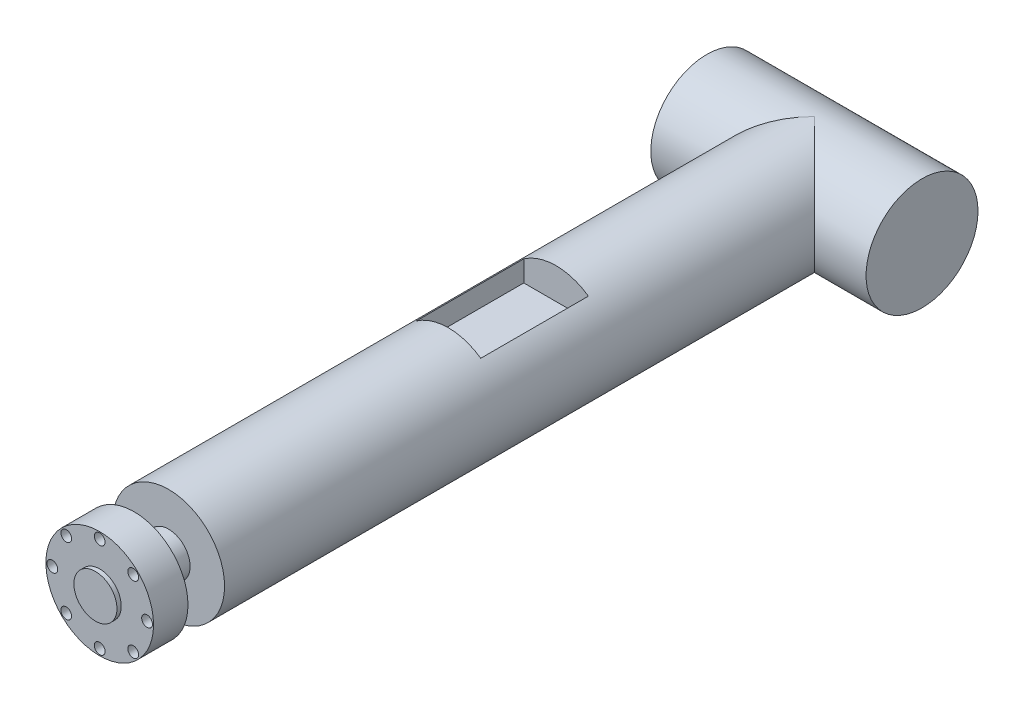
from build123d import *

# Parameters (mm, degrees)
AUFSATZ_LINEAR_AUSTRAGEN1_DEPTH      = 25
AUFSATZ_LINEAR_AUSTRAGEN1_DEPTH_BACK = 25
SKIZZE1_R                            = 13
SKIZZE2_R                            = 13
AUFSATZ_LINEAR_AUSTRAGEN2_DEPTH      = 150
SKIZZE4_R                            = 5
AUFSATZ_LINEAR_AUSTRAGEN3_DEPTH      = 16
SKIZZE5_R                            = 12.5
AUFSATZ_LINEAR_AUSTRAGEN4_DEPTH      = 8
SKIZZE6_R                            = 5
AUFSATZ_LINEAR_AUSTRAGEN5_DEPTH      = 1
SCHNITT_LINEAR_AUSTRAGEN2_REACH      = 183.204
SKIZZE7_R                            = 1.25
SCHNITT_LINEAR_AUSTRAGEN3_REACH      = 171.901
SKIZZE8_W                            = 15
SKIZZE8_H                            = 25


with BuildPart() as part:
    # Skizze1 → Aufsatz-Linear austragen1 (new, two sides: drawn at the far end of the back side and taken through both)
    with BuildSketch(Plane(origin=(0, 0, 0), x_dir=(0, 0, -1), z_dir=(1, 0, 0)).offset(-AUFSATZ_LINEAR_AUSTRAGEN1_DEPTH_BACK)):
        Circle(SKIZZE1_R)
    extrude(amount=AUFSATZ_LINEAR_AUSTRAGEN1_DEPTH + AUFSATZ_LINEAR_AUSTRAGEN1_DEPTH_BACK)

    # Skizze2 → Aufsatz-Linear austragen2 (add)
    with BuildSketch(Plane.XY):
        Circle(SKIZZE2_R)
    extrude(amount=AUFSATZ_LINEAR_AUSTRAGEN2_DEPTH)

    # Skizze4 → Aufsatz-Linear austragen3 (add)
    with BuildSketch(Plane.XY.offset(150)):
        Circle(SKIZZE4_R)
    extrude(amount=AUFSATZ_LINEAR_AUSTRAGEN3_DEPTH)

    # Skizze5 → Aufsatz-Linear austragen4 (add)
    with BuildSketch(Plane.XY.offset(166)):
        Circle(SKIZZE5_R)
    extrude(amount=-AUFSATZ_LINEAR_AUSTRAGEN4_DEPTH)

    # Skizze6 → Aufsatz-Linear austragen5 (add)
    with BuildSketch(Plane.XY.offset(166)):
        Circle(SKIZZE6_R)
    extrude(amount=AUFSATZ_LINEAR_AUSTRAGEN5_DEPTH)

    # Skizze7 → Schnitt-Linear austragen2 (cut, up to next)
    with BuildSketch(Plane.XY.offset(166), mode=Mode.PRIVATE) as schnitt_linear_austragen2_sk1:
        with Locations((0, 11)):
            Circle(SKIZZE7_R)
    schnitt_linear_austragen2_tool1 = extrude(schnitt_linear_austragen2_sk1.sketch, amount=-SCHNITT_LINEAR_AUSTRAGEN2_REACH, mode=Mode.PRIVATE) & part.part
    # Skizze7 → Schnitt-Linear austragen2 (cut, up to next)
    with BuildSketch(Plane.XY.offset(166), mode=Mode.PRIVATE) as schnitt_linear_austragen2_sk2:
        with Locations((7.778174593, 7.778174593)):
            Circle(SKIZZE7_R)
    schnitt_linear_austragen2_tool2 = extrude(schnitt_linear_austragen2_sk2.sketch, amount=-SCHNITT_LINEAR_AUSTRAGEN2_REACH, mode=Mode.PRIVATE) & part.part
    # Skizze7 → Schnitt-Linear austragen2 (cut, up to next)
    with BuildSketch(Plane.XY.offset(166), mode=Mode.PRIVATE) as schnitt_linear_austragen2_sk3:
        with Locations((11, 0)):
            Circle(SKIZZE7_R)
    schnitt_linear_austragen2_tool3 = extrude(schnitt_linear_austragen2_sk3.sketch, amount=-SCHNITT_LINEAR_AUSTRAGEN2_REACH, mode=Mode.PRIVATE) & part.part
    # Skizze7 → Schnitt-Linear austragen2 (cut, up to next)
    with BuildSketch(Plane.XY.offset(166), mode=Mode.PRIVATE) as schnitt_linear_austragen2_sk4:
        with Locations((7.778174593, -7.778174593)):
            Circle(SKIZZE7_R)
    schnitt_linear_austragen2_tool4 = extrude(schnitt_linear_austragen2_sk4.sketch, amount=-SCHNITT_LINEAR_AUSTRAGEN2_REACH, mode=Mode.PRIVATE) & part.part
    # Skizze7 → Schnitt-Linear austragen2 (cut, up to next)
    with BuildSketch(Plane.XY.offset(166), mode=Mode.PRIVATE) as schnitt_linear_austragen2_sk5:
        with Locations((0, -11)):
            Circle(SKIZZE7_R)
    schnitt_linear_austragen2_tool5 = extrude(schnitt_linear_austragen2_sk5.sketch, amount=-SCHNITT_LINEAR_AUSTRAGEN2_REACH, mode=Mode.PRIVATE) & part.part
    # Skizze7 → Schnitt-Linear austragen2 (cut, up to next)
    with BuildSketch(Plane.XY.offset(166), mode=Mode.PRIVATE) as schnitt_linear_austragen2_sk6:
        with Locations((-7.778174593, -7.778174593)):
            Circle(SKIZZE7_R)
    schnitt_linear_austragen2_tool6 = extrude(schnitt_linear_austragen2_sk6.sketch, amount=-SCHNITT_LINEAR_AUSTRAGEN2_REACH, mode=Mode.PRIVATE) & part.part
    # Skizze7 → Schnitt-Linear austragen2 (cut, up to next)
    with BuildSketch(Plane.XY.offset(166), mode=Mode.PRIVATE) as schnitt_linear_austragen2_sk7:
        with Locations((-11, 0)):
            Circle(SKIZZE7_R)
    schnitt_linear_austragen2_tool7 = extrude(schnitt_linear_austragen2_sk7.sketch, amount=-SCHNITT_LINEAR_AUSTRAGEN2_REACH, mode=Mode.PRIVATE) & part.part
    # Skizze7 → Schnitt-Linear austragen2 (cut, up to next)
    with BuildSketch(Plane.XY.offset(166), mode=Mode.PRIVATE) as schnitt_linear_austragen2_sk8:
        with Locations((-7.778174593, 7.778174593)):
            Circle(SKIZZE7_R)
    schnitt_linear_austragen2_tool8 = extrude(schnitt_linear_austragen2_sk8.sketch, amount=-SCHNITT_LINEAR_AUSTRAGEN2_REACH, mode=Mode.PRIVATE) & part.part
    add(schnitt_linear_austragen2_tool1.solids().sort_by_distance((0, 11, 166))[0], mode=Mode.SUBTRACT)
    add(schnitt_linear_austragen2_tool2.solids().sort_by_distance((7.778175, 7.778175, 166))[0], mode=Mode.SUBTRACT)
    add(schnitt_linear_austragen2_tool3.solids().sort_by_distance((11, 0, 166))[0], mode=Mode.SUBTRACT)
    add(schnitt_linear_austragen2_tool4.solids().sort_by_distance((7.778175, -7.778175, 166))[0], mode=Mode.SUBTRACT)
    add(schnitt_linear_austragen2_tool5.solids().sort_by_distance((0, -11, 166))[0], mode=Mode.SUBTRACT)
    add(schnitt_linear_austragen2_tool6.solids().sort_by_distance((-7.778175, -7.778175, 166))[0], mode=Mode.SUBTRACT)
    add(schnitt_linear_austragen2_tool7.solids().sort_by_distance((-11, 0, 166))[0], mode=Mode.SUBTRACT)
    add(schnitt_linear_austragen2_tool8.solids().sort_by_distance((-7.778175, 7.778175, 166))[0], mode=Mode.SUBTRACT)

    # Skizze8 → Schnitt-Linear austragen3 (cut, up to next)
    with BuildSketch(Plane(origin=(0, 5.771219274, 0), x_dir=(1, 0, 0), z_dir=(0, 1, 0)), mode=Mode.PRIVATE) as schnitt_linear_austragen3_sk1:
        with Locations((0, -72.5)):
            Rectangle(SKIZZE8_W, SKIZZE8_H)
    schnitt_linear_austragen3_tool1 = extrude(schnitt_linear_austragen3_sk1.sketch, amount=SCHNITT_LINEAR_AUSTRAGEN3_REACH, mode=Mode.PRIVATE) & part.part
    add(schnitt_linear_austragen3_tool1.solids().sort_by_distance((0, 5.771219, 72.5))[0], mode=Mode.SUBTRACT)


solid = part.part
